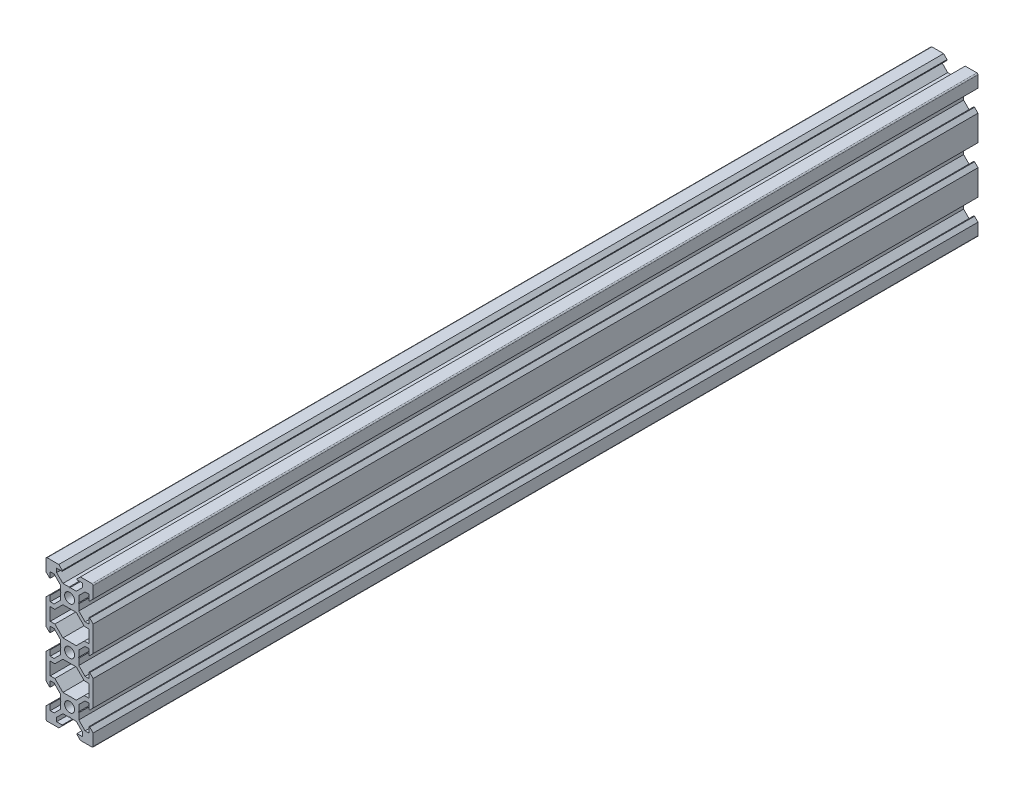
from build123d import *

# Parameters (mm, degrees)
SKETCH1_R           = 2.1
BOSS_EXTRUDE1_DEPTH = 375


with BuildPart() as part:
    # Sketch1 → Boss-Extrude1 (new body)
    with BuildSketch(Plane.XY):
        with BuildLine():
            Line((4.58, -30), (9.5, -30))
            ThreePointArc((9.5, -30), (9.853553391, -29.853553391), (10, -29.5))
            Line((10, -29.5), (10, -24.58))
            Line((10, -24.58), (8.545, -23.125))
            Line((8.545, -23.125), (8.2, -23.125))
            Line((8.2, -23.125), (8.2, -25.5))
            Line((8.2, -25.5), (6.560660172, -25.5))
            Line((6.560660172, -25.5), (3.9, -22.839339828))
            Line((3.9, -22.839339828), (3.9, -20.21))
            Line((3.9, -20.21), (3.69, -20))
            Line((3.69, -20), (3.9, -19.79))
            Line((3.9, -19.79), (3.9, -17.160660172))
            Line((3.9, -17.160660172), (6.560660172, -14.5))
            Line((6.560660172, -14.5), (8.2, -14.5))
            Line((8.2, -14.5), (8.2, -16.875))
            Line((8.2, -16.875), (8.545, -16.875))
            Line((8.545, -16.875), (10, -15.42))
            Line((10, -15.42), (10, -4.58))
            Line((10, -4.58), (8.545, -3.125))
            Line((8.545, -3.125), (8.2, -3.125))
            Line((8.2, -3.125), (8.2, -5.5))
            Line((8.2, -5.5), (6.560660172, -5.5))
            Line((6.560660172, -5.5), (3.9, -2.839339828))
            Line((3.9, -2.839339828), (3.9, -0.21))
            Line((3.9, -0.21), (3.69, 0))
            Line((3.69, 0), (3.9, 0.21))
            Line((3.9, 0.21), (3.9, 2.839339828))
            Line((3.9, 2.839339828), (6.560660172, 5.5))
            Line((6.560660172, 5.5), (8.2, 5.5))
            Line((8.2, 5.5), (8.2, 3.125))
            Line((8.2, 3.125), (8.545, 3.125))
            Line((8.545, 3.125), (10, 4.58))
            Line((10, 4.58), (10, 15.42))
            Line((10, 15.42), (8.545, 16.875))
            Line((8.545, 16.875), (8.2, 16.875))
            Line((8.2, 16.875), (8.2, 14.5))
            Line((8.2, 14.5), (6.560660172, 14.5))
            Line((6.560660172, 14.5), (3.9, 17.160660172))
            Line((3.9, 17.160660172), (3.9, 19.79))
            Line((3.9, 19.79), (3.69, 20))
            Line((3.69, 20), (3.9, 20.21))
            Line((3.9, 20.21), (3.9, 22.839339828))
            Line((3.9, 22.839339828), (6.560660172, 25.5))
            Line((6.560660172, 25.5), (8.2, 25.5))
            Line((8.2, 25.5), (8.2, 23.125))
            Line((8.2, 23.125), (8.545, 23.125))
            Line((8.545, 23.125), (10, 24.58))
            Line((10, 24.58), (10, 29.5))
            ThreePointArc((10, 29.5), (9.853553391, 29.853553391), (9.5, 30))
            Line((9.5, 30), (4.58, 30))
            Line((4.58, 30), (3.125, 28.545))
            Line((3.125, 28.545), (3.125, 28.2))
            Line((3.125, 28.2), (5.5, 28.2))
            Line((5.5, 28.2), (5.5, 26.560660172))
            Line((5.5, 26.560660172), (2.839339828, 23.9))
            Line((2.839339828, 23.9), (0.21, 23.9))
            Line((0.21, 23.9), (0, 23.69))
            Line((0, 23.69), (-0.21, 23.9))
            Line((-0.21, 23.9), (-2.839339828, 23.9))
            Line((-2.839339828, 23.9), (-5.5, 26.560660172))
            Line((-5.5, 26.560660172), (-5.5, 28.2))
            Line((-5.5, 28.2), (-3.125, 28.2))
            Line((-3.125, 28.2), (-3.125, 28.545))
            Line((-3.125, 28.545), (-4.58, 30))
            Line((-4.58, 30), (-9.5, 30))
            ThreePointArc((-9.5, 30), (-9.853553391, 29.853553391), (-10, 29.5))
            Line((-10, 29.5), (-10, 24.58))
            Line((-10, 24.58), (-8.545, 23.125))
            Line((-8.545, 23.125), (-8.2, 23.125))
            Line((-8.2, 23.125), (-8.2, 25.5))
            Line((-8.2, 25.5), (-6.560660172, 25.5))
            Line((-6.560660172, 25.5), (-3.9, 22.839339828))
            Line((-3.9, 22.839339828), (-3.9, 20.21))
            Line((-3.9, 20.21), (-3.69, 20))
            Line((-3.69, 20), (-3.9, 19.79))
            Line((-3.9, 19.79), (-3.9, 17.160660172))
            Line((-3.9, 17.160660172), (-6.560660172, 14.5))
            Line((-6.560660172, 14.5), (-8.2, 14.5))
            Line((-8.2, 14.5), (-8.2, 16.875))
            Line((-8.2, 16.875), (-8.545, 16.875))
            Line((-8.545, 16.875), (-10, 15.42))
            Line((-10, 15.42), (-10, 4.58))
            Line((-10, 4.58), (-8.545, 3.125))
            Line((-8.545, 3.125), (-8.2, 3.125))
            Line((-8.2, 3.125), (-8.2, 5.5))
            Line((-8.2, 5.5), (-6.560660172, 5.5))
            Line((-6.560660172, 5.5), (-3.9, 2.839339828))
            Line((-3.9, 2.839339828), (-3.9, 0.21))
            Line((-3.9, 0.21), (-3.69, 0))
            Line((-3.69, 0), (-3.9, -0.21))
            Line((-3.9, -0.21), (-3.9, -2.839339828))
            Line((-3.9, -2.839339828), (-6.560660172, -5.5))
            Line((-6.560660172, -5.5), (-8.2, -5.5))
            Line((-8.2, -5.5), (-8.2, -3.125))
            Line((-8.2, -3.125), (-8.545, -3.125))
            Line((-8.545, -3.125), (-10, -4.58))
            Line((-10, -4.58), (-10, -15.42))
            Line((-10, -15.42), (-8.545, -16.875))
            Line((-8.545, -16.875), (-8.2, -16.875))
            Line((-8.2, -16.875), (-8.2, -14.5))
            Line((-8.2, -14.5), (-6.560660172, -14.5))
            Line((-6.560660172, -14.5), (-3.9, -17.160660172))
            Line((-3.9, -17.160660172), (-3.9, -19.79))
            Line((-3.9, -19.79), (-3.69, -20))
            Line((-3.69, -20), (-3.9, -20.21))
            Line((-3.9, -20.21), (-3.9, -22.839339828))
            Line((-3.9, -22.839339828), (-6.560660172, -25.5))
            Line((-6.560660172, -25.5), (-8.2, -25.5))
            Line((-8.2, -25.5), (-8.2, -23.125))
            Line((-8.2, -23.125), (-8.545, -23.125))
            Line((-8.545, -23.125), (-10, -24.58))
            Line((-10, -24.58), (-10, -29.5))
            ThreePointArc((-10, -29.5), (-9.853553391, -29.853553391), (-9.5, -30))
            Line((-9.5, -30), (-4.58, -30))
            Line((-4.58, -30), (-3.125, -28.545))
            Line((-3.125, -28.545), (-3.125, -28.2))
            Line((-3.125, -28.2), (-5.5, -28.2))
            Line((-5.5, -28.2), (-5.5, -26.560660172))
            Line((-5.5, -26.560660172), (-2.839339828, -23.9))
            Line((-2.839339828, -23.9), (-0.21, -23.9))
            Line((-0.21, -23.9), (0, -23.69))
            Line((0, -23.69), (0.21, -23.9))
            Line((0.21, -23.9), (2.839339828, -23.9))
            Line((2.839339828, -23.9), (5.5, -26.560660172))
            Line((5.5, -26.560660172), (5.5, -28.2))
            Line((5.5, -28.2), (3.125, -28.2))
            Line((3.125, -28.2), (3.125, -28.545))
            Line((3.125, -28.545), (4.58, -30))
        make_face()
        with Locations((0, -20)):
            Circle(SKETCH1_R, mode=Mode.SUBTRACT)
        Polygon((-6.239339828, -12.7), (-8.2, -12.7), (-8.2, -7.3), (-6.239339828, -7.3), (-2.839339828, -3.9), (2.839339828, -3.9), (6.239339828, -7.3), (8.2, -7.3), (8.2, -12.7), (6.239339828, -12.7), (2.839339828, -16.1), (-2.839339828, -16.1), align=None, mode=Mode.SUBTRACT)
        Polygon((-6.239339828, 7.3), (-8.2, 7.3), (-8.2, 12.7), (-6.239339828, 12.7), (-2.839339828, 16.1), (2.839339828, 16.1), (6.239339828, 12.7), (8.2, 12.7), (8.2, 7.3), (6.239339828, 7.3), (2.839339828, 3.9), (-2.839339828, 3.9), align=None, mode=Mode.SUBTRACT)
        with Locations((0, 20)):
            Circle(SKETCH1_R, mode=Mode.SUBTRACT)
        Circle(SKETCH1_R, mode=Mode.SUBTRACT)
    extrude(amount=BOSS_EXTRUDE1_DEPTH)


solid = part.part
